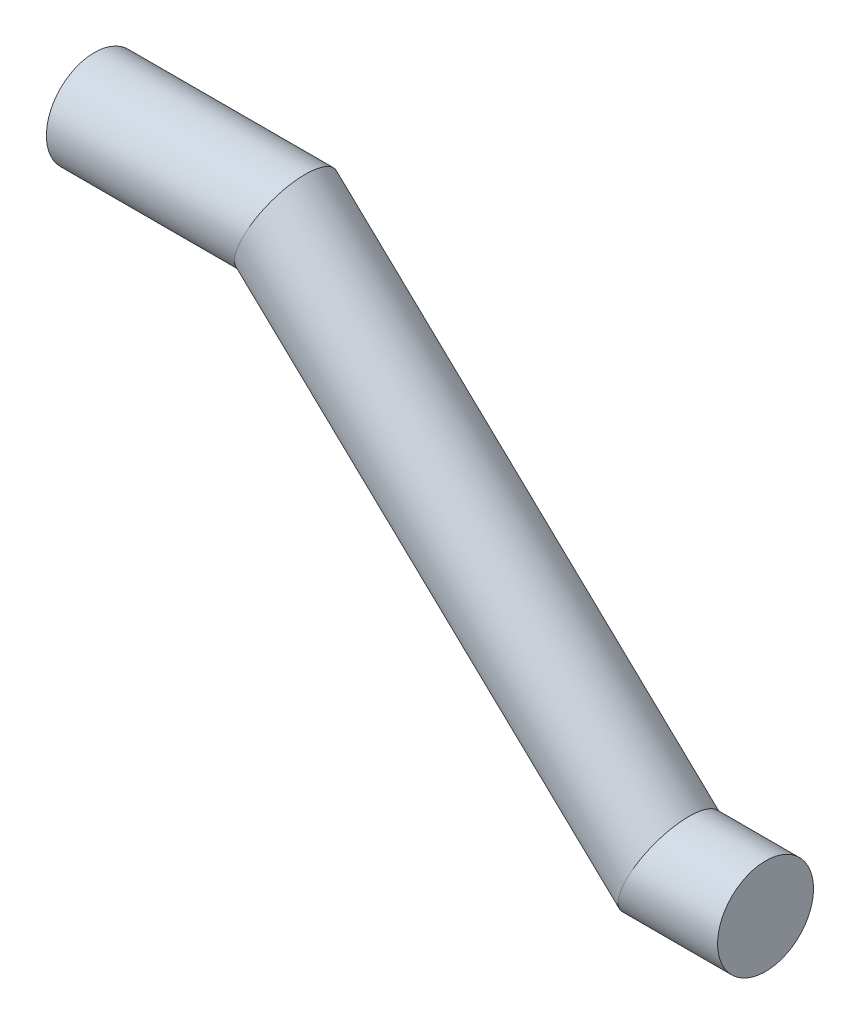
from build123d import *

# Parameters (mm, degrees)
SKETCH1_R = 25


with BuildPart() as part:
    # Sweep1: sweep along a path in Sketch2
    with BuildLine(Plane.XY) as sweep1_path:
        Line((0, 0), (100, 0))
        Line((100, 0), (300, -190))
        Line((300, -190), (350, -190))
    # Sketch1 → Sweep1 (sweep)
    with BuildSketch(Plane(origin=(0, 0, 0), x_dir=(0, 0, -1), z_dir=(1, 0, 0))):
        Circle(SKETCH1_R)
    sweep(path=sweep1_path.line, transition=Transition.RIGHT)


solid = part.part
